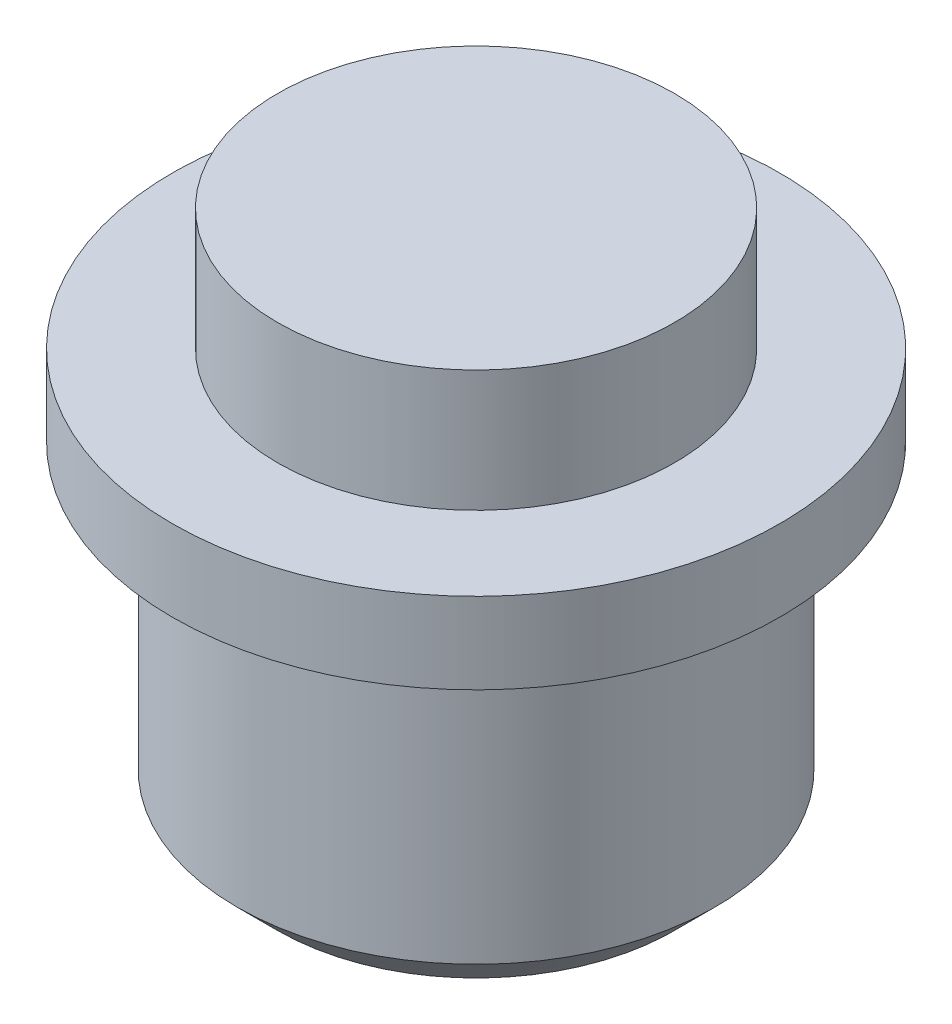
from build123d import *

# Parameters (mm, degrees)
SKETCH1_R           = 4.9
BOSS_EXTRUDE1_DEPTH = 5
SKETCH2_R           = 7.5
BOSS_EXTRUDE2_DEPTH = 2
SKETCH3_R           = 5.9
BOSS_EXTRUDE3_DEPTH = 8
CHAMFER1_SIZE       = 1


with BuildPart() as part:
    # Sketch1 → Boss-Extrude1 (new body)
    with BuildSketch(Plane(origin=(0, 0, 0), x_dir=(1, 0, 0), z_dir=(0, 1, 0))):
        with Locations(Location((0, 0, 0), (0, 0, 270))):
            Circle(SKETCH1_R)
    extrude(amount=BOSS_EXTRUDE1_DEPTH)

    # Sketch2 → Boss-Extrude2 (add)
    with BuildSketch(Plane(origin=(0, 1.999999904, 0), x_dir=(1, 0, 0), z_dir=(0, 1, 0))):
        with Locations(Location((0, 0, 0), (0, 0, 270))):
            Circle(SKETCH2_R)
    extrude(amount=-BOSS_EXTRUDE2_DEPTH)

    # Sketch3 → Boss-Extrude3 (add)
    with BuildSketch(Plane(origin=(0, 0, 0), x_dir=(1, 0, 0), z_dir=(0, 1, 0))):
        with Locations(Location((0, 0, 0), (0, 0, 270))):
            Circle(SKETCH3_R)
    extrude(amount=-BOSS_EXTRUDE3_DEPTH)

    # Chamfer1
    chamfer1_edges = [part.edges().sort_by_distance(p)[0] for p in [
        (0, -8, -5.9),
    ]]
    chamfer(chamfer1_edges, length=CHAMFER1_SIZE)


solid = part.part
